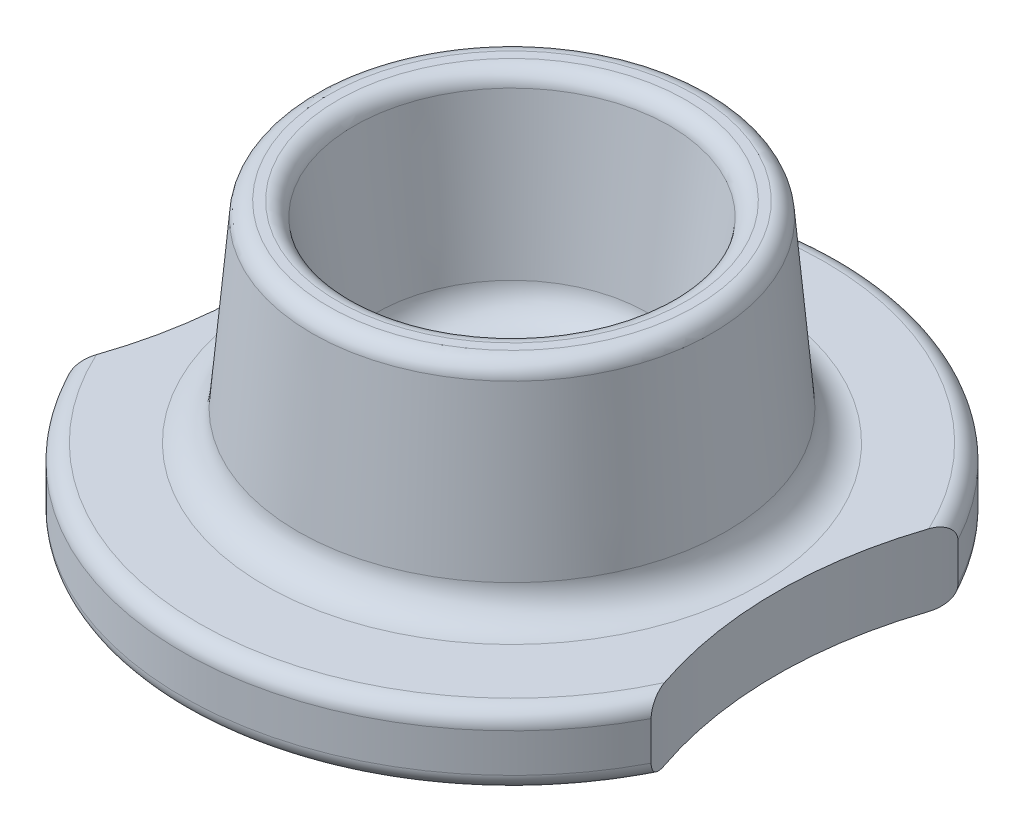
from build123d import *

# Parameters (mm, degrees)
FILETE1_R             = 6
FILETE2_R             = 6
FILETE3_R             = 3
FILETE4_R             = 3
FILETE5_R             = 3
FILETE6_R             = 3
FILETE7_R             = 3
FILETE8_R             = 6
FILETE9_R             = 2
ESBO_O2_R             = 75
CORTE_EXTRUS_O3_DEPTH = 111.093672947


with BuildPart() as part:
    # Esboço1 → Revolução1 (revolve)
    with BuildSketch(Plane.XY, mode=Mode.PRIVATE) as revolu_o1_sk:
        Polygon((46.383354153, 40.76592827), (53.383354153, 40.76592827), (56.703354153, 2.76592827), (77.133354153, 2.76592827), (77.133354153, -10.23407173), (49.783354153, -10.23407173), (48.133354153, -28.93407173), (40.883354153, -28.93407173), (38.437038363, -0.93407173), (17.383354153, -0.93407173), (17.383354153, 5.76592827), (41.203354153, 5.76592827), align=None)
    revolve(revolu_o1_sk.sketch.rotate(Axis((17.383354153, 40.76592827, 0), (0, -1, 0)), 90), axis=Axis((17.383354153, 40.76592827, 0), (0, -1, 0)))

    # Filete1
    filete1_edges = [part.edges().sort_by_distance(p)[0] for p in [
        (17.383354153, 5.76592827, -23.82),
    ]]
    fillet(filete1_edges, radius=FILETE1_R)

    # Filete2
    filete2_edges = [part.edges().sort_by_distance(p)[0] for p in [
        (17.383354153, -0.93407173, -21.053684211),
    ]]
    fillet(filete2_edges, radius=FILETE2_R)

    # Filete3
    filete3_edges = [part.edges().sort_by_distance(p)[0] for p in [
        (17.383354153, -10.23407173, -32.4),
    ]]
    fillet(filete3_edges, radius=FILETE3_R)

    # Filete4
    filete4_edges = [part.edges().sort_by_distance(p)[0] for p in [
        (17.383354153, -10.23407173, -59.75),
    ]]
    fillet(filete4_edges, radius=FILETE4_R)

    # Filete5
    filete5_edges = [part.edges().sort_by_distance(p)[0] for p in [
        (17.383354153, 2.76592827, -59.75),
    ]]
    fillet(filete5_edges, radius=FILETE5_R)

    # Filete6
    filete6_edges = [part.edges().sort_by_distance(p)[0] for p in [
        (17.383354153, 40.76592827, -36),
    ]]
    fillet(filete6_edges, radius=FILETE6_R)

    # Filete7
    filete7_edges = [part.edges().sort_by_distance(p)[0] for p in [
        (17.383354153, 40.76592827, -29),
    ]]
    fillet(filete7_edges, radius=FILETE7_R)

    # Filete8
    filete8_edges = [part.edges().sort_by_distance(p)[0] for p in [
        (17.383354153, 2.76592827, -39.32),
    ]]
    fillet(filete8_edges, radius=FILETE8_R)

    # Filete9
    filete9_edges = [part.edges().sort_by_distance(p)[0] for p in [
        (17.383354153, -28.93407173, -23.5),
        (17.383354153, -28.93407173, -30.75),
    ]]
    fillet(filete9_edges, radius=FILETE9_R)

    # Esboço2 → Corte-extrusão3 (cut, through all)
    with BuildSketch(Plane.XZ.offset(10.23407173)):
        with Locations((139.81318724, -0.506060637)):
            Circle(ESBO_O2_R)
        with Locations((-105.046478935, -0.506060637)):
            Circle(ESBO_O2_R)
    extrude(amount=-CORTE_EXTRUS_O3_DEPTH, mode=Mode.SUBTRACT)


solid = part.part
